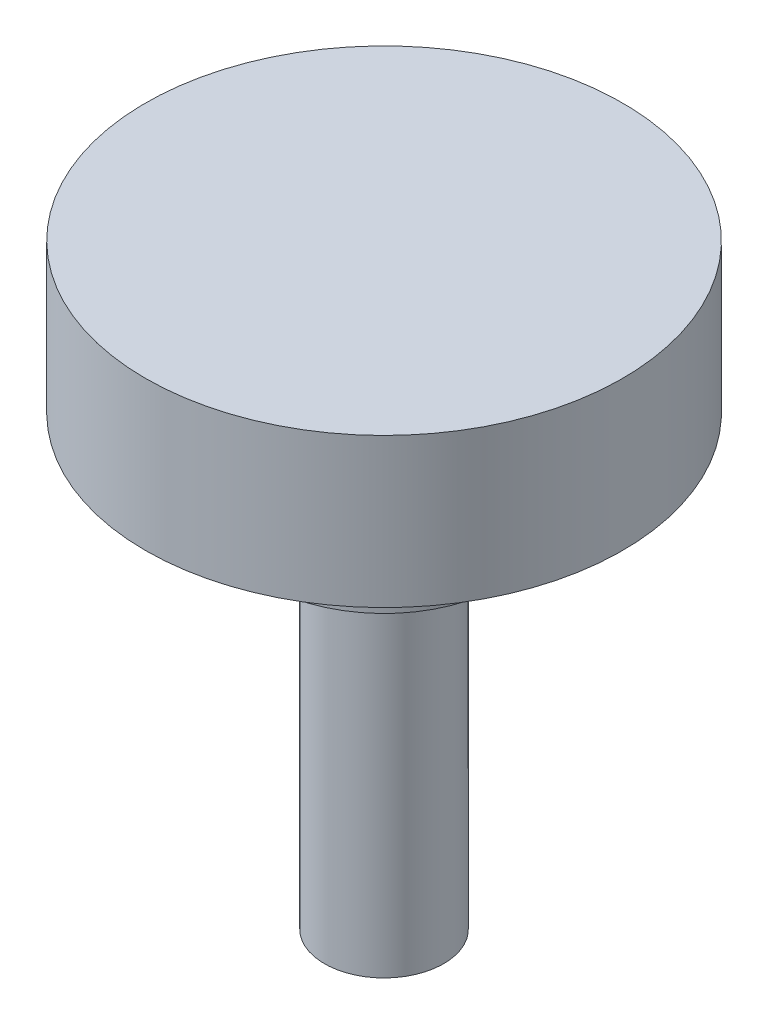
from build123d import *

# Parameters (mm, degrees)
SKETCH1_R           = 3.175
BOSS_EXTRUDE1_DEPTH = 19.05
SKETCH2_R           = 6.35
BOSS_EXTRUDE2_DEPTH = 4.7625
SKETCH3_R           = 12.7
BOSS_EXTRUDE3_DEPTH = 7.9375


with BuildPart() as part:
    # Sketch1 → Boss-Extrude1 (new body)
    with BuildSketch(Plane(origin=(0, 0, 0), x_dir=(1, 0, 0), z_dir=(0, 1, 0))):
        with Locations(Location((0, 0, 0), (0, 0, 90))):
            Circle(SKETCH1_R)
    extrude(amount=BOSS_EXTRUDE1_DEPTH)

    # Sketch2 → Boss-Extrude2 (add)
    with BuildSketch(Plane(origin=(0, 19.05, 0), x_dir=(1, 0, 0), z_dir=(0, 1, 0))):
        with Locations(Location((0, 0, 0), (0, 0, 90))):
            Circle(SKETCH2_R)
    extrude(amount=BOSS_EXTRUDE2_DEPTH)

    # Sketch3 → Boss-Extrude3 (add)
    with BuildSketch(Plane(origin=(0, 23.8125, 0), x_dir=(1, 0, 0), z_dir=(0, 1, 0))):
        with Locations(Location((0, 0, 0), (0, 0, 270))):
            Circle(SKETCH3_R)
    extrude(amount=BOSS_EXTRUDE3_DEPTH)


solid = part.part
